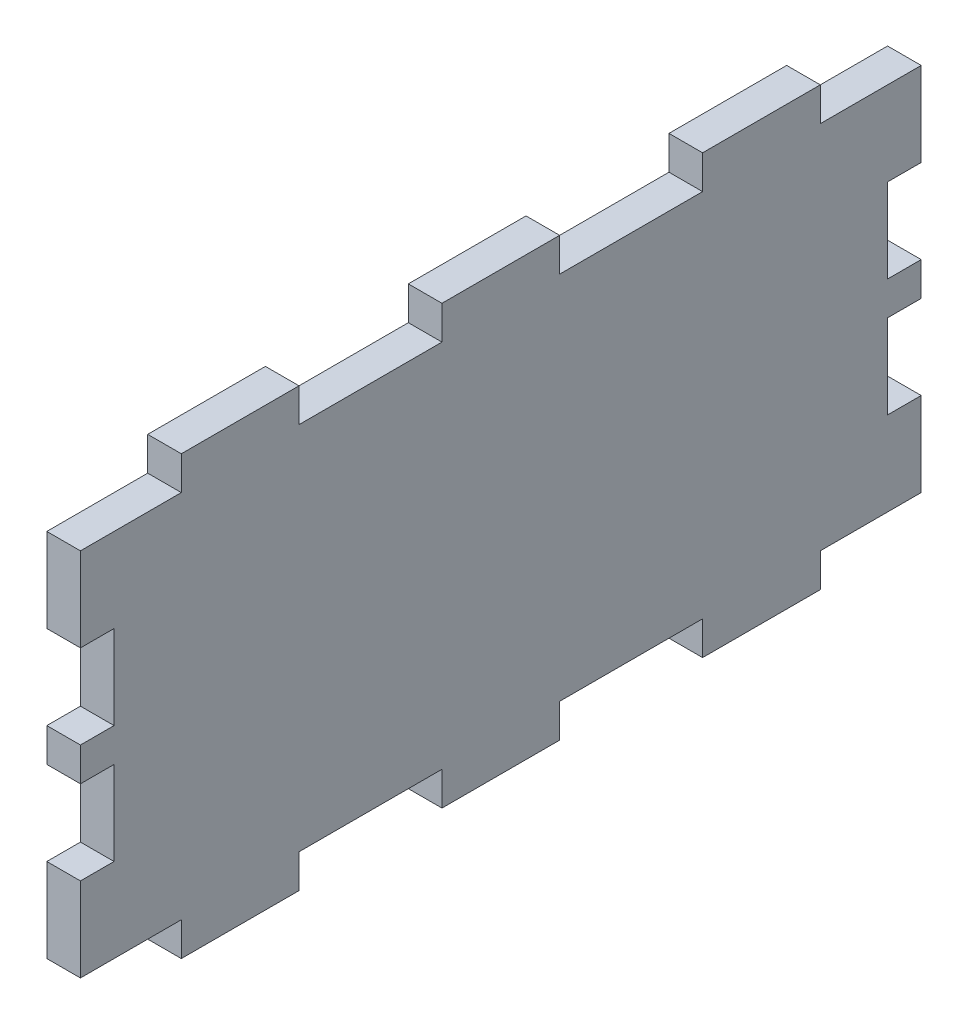
from build123d import *

# Parameters (mm, degrees)
BOSS_EXTRUDE1_DEPTH = 2


with BuildPart() as part:
    # Sketch1 → Boss-Extrude1 (new body)
    with BuildSketch(Plane(origin=(0, 0, 0), x_dir=(0, 0, -1), z_dir=(1, 0, 0))):
        Polygon((-19, 11), (-25, 11), (-25, 6), (-23, 6), (-23, 1), (-25, 1), (-25, -1), (-23, -1), (-23, -6), (-25, -6), (-25, -11), (-19, -11), (-19, -13), (-12, -13), (-12, -11), (-3.5, -11), (-3.5, -13), (3.5, -13), (3.5, -11), (12, -11), (12, -13), (19, -13), (19, -11), (25, -11), (25, -6), (23, -6), (23, -1), (25, -1), (25, 1), (23, 1), (23, 6), (25, 6), (25, 11), (19, 11), (19, 13), (12, 13), (12, 11), (3.5, 11), (3.5, 13), (-3.5, 13), (-3.5, 11), (-12, 11), (-12, 13), (-19, 13), align=None)
    extrude(amount=BOSS_EXTRUDE1_DEPTH)


solid = part.part
